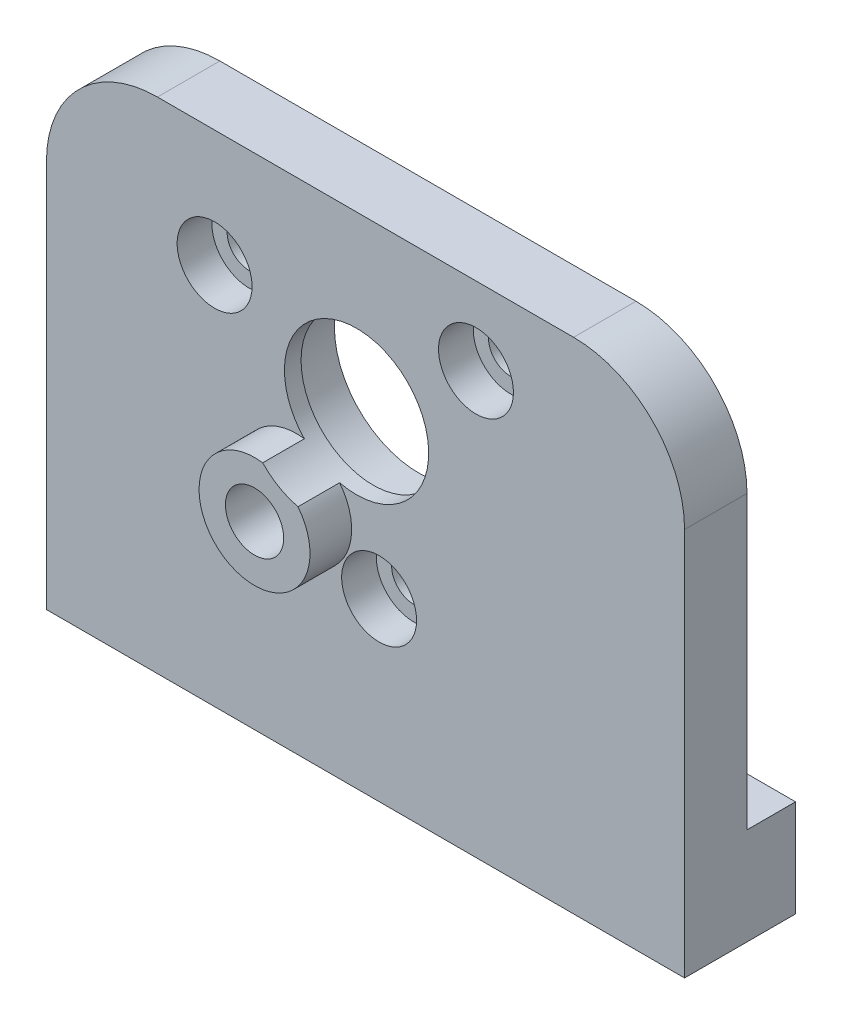
from build123d import *

# Parameters (mm, degrees)
SKETCH1_W                                        = 46
SKETCH1_H                                        = 36
BOSS_EXTRUDE1_DEPTH                              = 4.5
SKETCH2_W                                        = 8
SKETCH2_H                                        = 7
BOSS_EXTRUDE2_DEPTH                              = 3.5
SKETCH3_W                                        = 7.999999995
SKETCH3_H                                        = 7
BOSS_EXTRUDE3_DEPTH                              = 3.5
SKETCH4_W                                        = 4
SKETCH4_H                                        = 3
F_1_7_1_7_DIAMETER_HOLE1_D                       = 1.7
F_1_7_1_7_DIAMETER_HOLE1_DEPTH                   = 7
F_1_7_1_7_DIAMETER_HOLE1_TIP                     = 0.510731526
F_2_5_2_5_DIAMETER_HOLE1_D                       = 2.5
F_2_5_2_5_DIAMETER_HOLE1_DEPTH                   = 6
F_2_5_2_5_DIAMETER_HOLE1_TIP                     = 0.751075774
HOLE1_D                                          = 10.4
HOLE1_CBORE_D                                    = 12.2
HOLE1_CBORE_DEPTH                                = 3.3
CBORE_FOR_M3_HEX_HEAD_MACHINE_SCREW1_D           = 3.2
CBORE_FOR_M3_HEX_HEAD_MACHINE_SCREW1_DEPTH       = 8.000025
CBORE_FOR_M3_HEX_HEAD_MACHINE_SCREW1_CBORE_D     = 5.4
CBORE_FOR_M3_HEX_HEAD_MACHINE_SCREW1_CBORE_DEPTH = 2.5
F_4_2_4_2_DIAMETER_HOLE1_D                       = 4.2
F_4_2_4_2_DIAMETER_HOLE1_DEPTH                   = 7
FILLET1_R                                        = 3
FILLET2_R                                        = 8


with BuildPart() as part:
    # Sketch1 → Boss-Extrude1 (new body)
    with BuildSketch(Plane.XY.offset(4.5)):
        Rectangle(SKETCH1_W, SKETCH1_H)
    extrude(amount=-BOSS_EXTRUDE1_DEPTH)

    # Sketch2 → Boss-Extrude2 (add)
    with BuildSketch(Plane(origin=(0, 0, 0), x_dir=(-1, 0, 0), z_dir=(0, 0, -1))):
        with Locations((-19, -14.5)):
            Rectangle(SKETCH2_W, SKETCH2_H)
    extrude(amount=BOSS_EXTRUDE2_DEPTH)

    # Sketch3 → Boss-Extrude3 (add)
    with BuildSketch(Plane(origin=(0, 0, 0), x_dir=(-1, 0, 0), z_dir=(0, 0, -1))):
        with Locations((19.000000003, -14.5)):
            Rectangle(SKETCH3_W, SKETCH3_H)
    extrude(amount=BOSS_EXTRUDE3_DEPTH)

    # Sketch4 → Revolve1 (revolve)
    with BuildSketch(Plane.XZ.offset(2), mode=Mode.PRIVATE) as revolve1_sk:
        with Locations((-3, 6)):
            Rectangle(SKETCH4_W, SKETCH4_H)
    revolve(revolve1_sk.sketch.rotate(Axis((-5, -2, 7.5), (0, 0, -1)), 180), axis=Axis((-5, -2, 7.5), (0, 0, -1)))

    # Ø1.7 (1.7) Diameter Hole1
    with Locations(Plane(origin=(0, -18, 0), x_dir=(-1, 0, 0), z_dir=(0, -1, 0))):
        with Locations((0, -2.25)):
            Hole(F_1_7_1_7_DIAMETER_HOLE1_D / 2, depth=F_1_7_1_7_DIAMETER_HOLE1_DEPTH)
            with Locations((0, 0, -(F_1_7_1_7_DIAMETER_HOLE1_DEPTH + F_1_7_1_7_DIAMETER_HOLE1_TIP / 2))):  # 118° drill point
                Cone(0, F_1_7_1_7_DIAMETER_HOLE1_D / 2, F_1_7_1_7_DIAMETER_HOLE1_TIP, mode=Mode.SUBTRACT)

    # Ø2.5 (2.5) Diameter Hole1
    with Locations(Plane(origin=(0, -18, 0), x_dir=(-1, 0, 0), z_dir=(0, -1, 0))):
        with Locations((-19, -0.5), (19, -0.5)):
            Hole(F_2_5_2_5_DIAMETER_HOLE1_D / 2, depth=F_2_5_2_5_DIAMETER_HOLE1_DEPTH)
            with Locations((0, 0, -(F_2_5_2_5_DIAMETER_HOLE1_DEPTH + F_2_5_2_5_DIAMETER_HOLE1_TIP / 2))):  # 118° drill point
                Cone(0, F_2_5_2_5_DIAMETER_HOLE1_D / 2, F_2_5_2_5_DIAMETER_HOLE1_TIP, mode=Mode.SUBTRACT)

    # Hole1 (through all)
    with Locations(Plane(origin=(0, 0, 0), x_dir=(-1, 0, 0), z_dir=(0, 0, -1))):
        with Locations((0.645780782, 5.541728913)):
            CounterBoreHole(HOLE1_D / 2, HOLE1_CBORE_D / 2, HOLE1_CBORE_DEPTH)

    # CBORE for M3 Hex Head Machine Screw1
    with Locations(Plane.XY.offset(4.5)):
        with Locations((0.980122741, -5.337445584), (7.962908944, 12.389389916), (-10.88037403, 9.573242407)):
            CounterBoreHole(CBORE_FOR_M3_HEX_HEAD_MACHINE_SCREW1_D / 2, CBORE_FOR_M3_HEX_HEAD_MACHINE_SCREW1_CBORE_D / 2, CBORE_FOR_M3_HEX_HEAD_MACHINE_SCREW1_CBORE_DEPTH, depth=CBORE_FOR_M3_HEX_HEAD_MACHINE_SCREW1_DEPTH)

    # Ø4.2 (4.2) Diameter Hole1
    with Locations(Plane.XY.offset(7.5)):
        with Locations((-5, -2)):
            Hole(F_4_2_4_2_DIAMETER_HOLE1_D / 2, depth=F_4_2_4_2_DIAMETER_HOLE1_DEPTH)

    # Fillet1
    fillet1_edges = [part.edges().sort_by_distance(p)[0] for p in [
        (-15.000000005, -11, -1.75),
        (15, -11, -1.75),
    ]]
    fillet(fillet1_edges, radius=FILLET1_R)

    # Fillet2
    fillet2_edges = [part.edges().sort_by_distance(p)[0] for p in [
        (-23, 18, 2.25),
        (23, 18, 2.25),
    ]]
    fillet(fillet2_edges, radius=FILLET2_R)


solid = part.part
